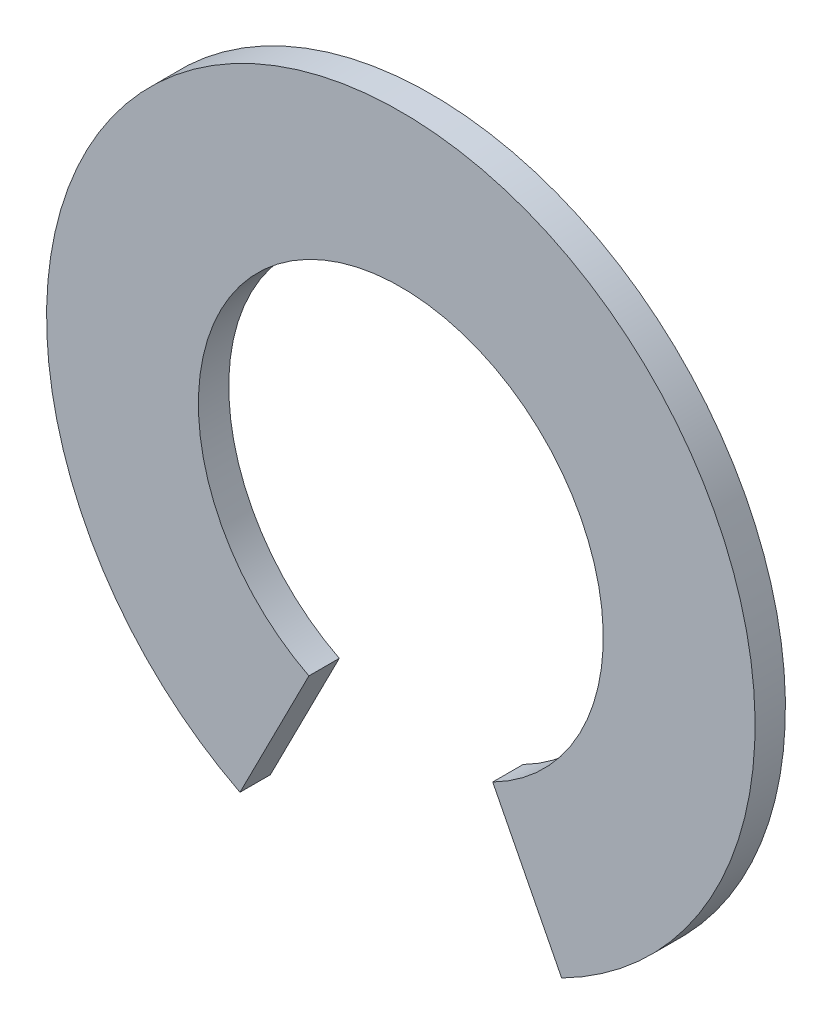
from build123d import *

# Parameters (mm, degrees)
BOSS_EXTRUDE1_DEPTH = 1.5


with BuildPart() as part:
    # Sketch1 → Boss-Extrude1 (new body)
    with BuildSketch(Plane.XY):
        with BuildLine():
            Line((-4.539904997, -8.910065242), (-7.944833745, -15.592614173))
            ThreePointArc((-7.944833745, -15.592614173), (0, 17.5), (7.944833745, -15.592614173))
            Line((7.944833745, -15.592614173), (4.539904997, -8.910065242))
            ThreePointArc((4.539904997, -8.910065242), (0, 10), (-4.539904997, -8.910065242))
        make_face()
    extrude(amount=BOSS_EXTRUDE1_DEPTH)


solid = part.part
